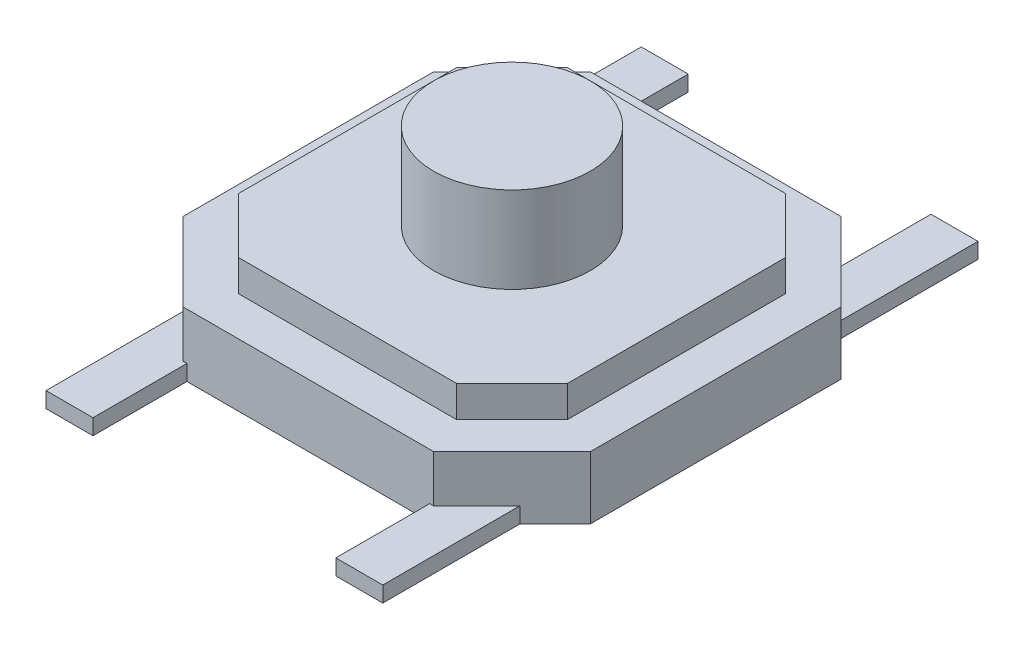
from build123d import *

# Parameters (mm, degrees)
SKETCH_1_W         = 5.2
SKETCH_1_H         = 5.2
EXTRUDE_1_DEPTH    = 0.8
CHAMFER_1_SIZE     = 1
EXTRUDE_1_2_DEPTH  = 0.4
SKETCH_2_R         = 1
EXTRUDE_1110_DEPTH = 1.1
SKETCH_4_W         = 0.6
SKETCH_4_H         = 2.66831223
EXTRUDE_2_DEPTH    = 0.2


with BuildPart() as part:
    # 草图1 → Extrude 1 (new body)
    with BuildSketch(Plane(origin=(0, 0, 0), x_dir=(1, 0, 0), z_dir=(0, 1, 0))):
        Rectangle(SKETCH_1_W, SKETCH_1_H)
    extrude(amount=EXTRUDE_1_DEPTH)

    # 倒角1
    chamfer_1_edges = [part.edges().sort_by_distance(p)[0] for p in [
        (-2.6, 0.4, -2.6),
        (2.6, 0.4, -2.6),
        (2.6, 0.4, 2.6),
        (-2.6, 0.4, 2.6),
    ]]
    chamfer(chamfer_1_edges, length=CHAMFER_1_SIZE)

    # 草图3 → Extrude 1 2 (add)
    with BuildSketch(Plane(origin=(0, 0.8, 0), x_dir=(1, 0, 0), z_dir=(0, 1, 0))):
        Polygon((-2.1, 1.392893219), (-2.1, -1.392893219), (-1.392893219, -2.1), (1.392893219, -2.1), (2.1, -1.392893219), (2.1, 1.392893219), (1.392893219, 2.1), (-1.392893219, 2.1), align=None)
    extrude(amount=EXTRUDE_1_2_DEPTH)

    # 草图2 → Extrude 1110 (add)
    with BuildSketch(Plane(origin=(0, 1.2, 0), x_dir=(-1, 0, 0), z_dir=(0, 1, 0))):
        with Locations(Location((0, 0, 0), (0, 0, 90))):
            Circle(SKETCH_2_R)
    extrude(amount=EXTRUDE_1110_DEPTH)

    # 草图4 → 凸台-拉伸2 (add)
    with BuildSketch(Plane.XZ):
        with Locations((-1.85, 2.465843885)):
            Rectangle(SKETCH_4_W, SKETCH_4_H)
        with Locations((1.85, 2.465843885)):
            Rectangle(SKETCH_4_W, SKETCH_4_H)
        with Locations((1.85, -2.465843885)):
            Rectangle(SKETCH_4_W, SKETCH_4_H)
        with Locations((-1.85, -2.465843885)):
            Rectangle(SKETCH_4_W, SKETCH_4_H)
    extrude(amount=-EXTRUDE_2_DEPTH)


solid = part.part
